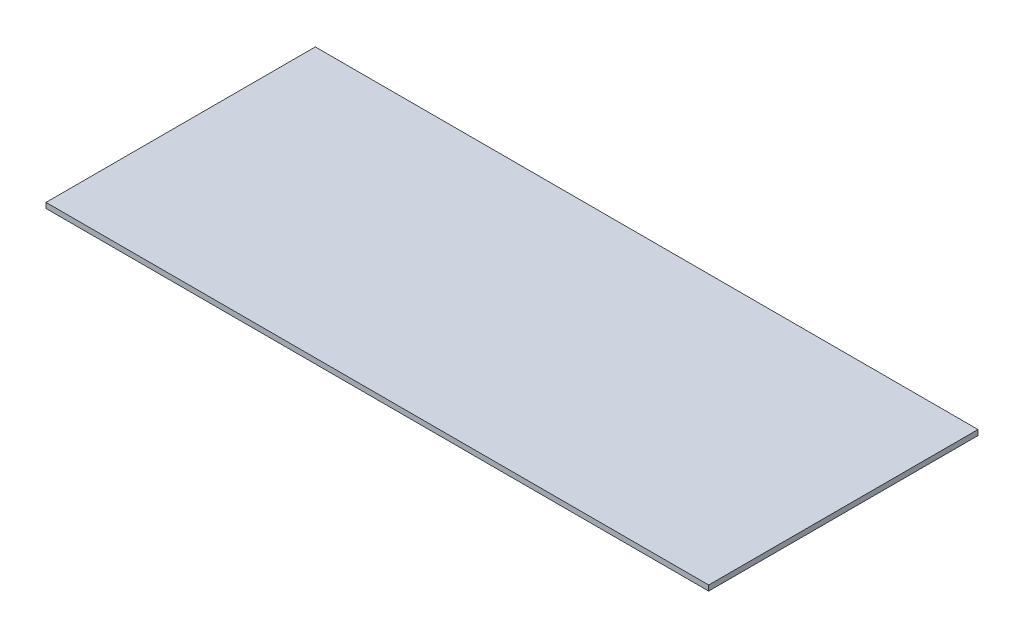
from build123d import *

# Parameters (mm, degrees)
SKETCH1_W           = 250
SKETCH1_H           = 101.6
BOSS_EXTRUDE1_DEPTH = 2


with BuildPart() as part:
    # Sketch1 → Boss-Extrude1 (new body)
    with BuildSketch(Plane(origin=(0, 0, 0), x_dir=(1, 0, 0), z_dir=(0, 1, 0))):
        Rectangle(SKETCH1_W, SKETCH1_H)
    extrude(amount=BOSS_EXTRUDE1_DEPTH)


solid = part.part
